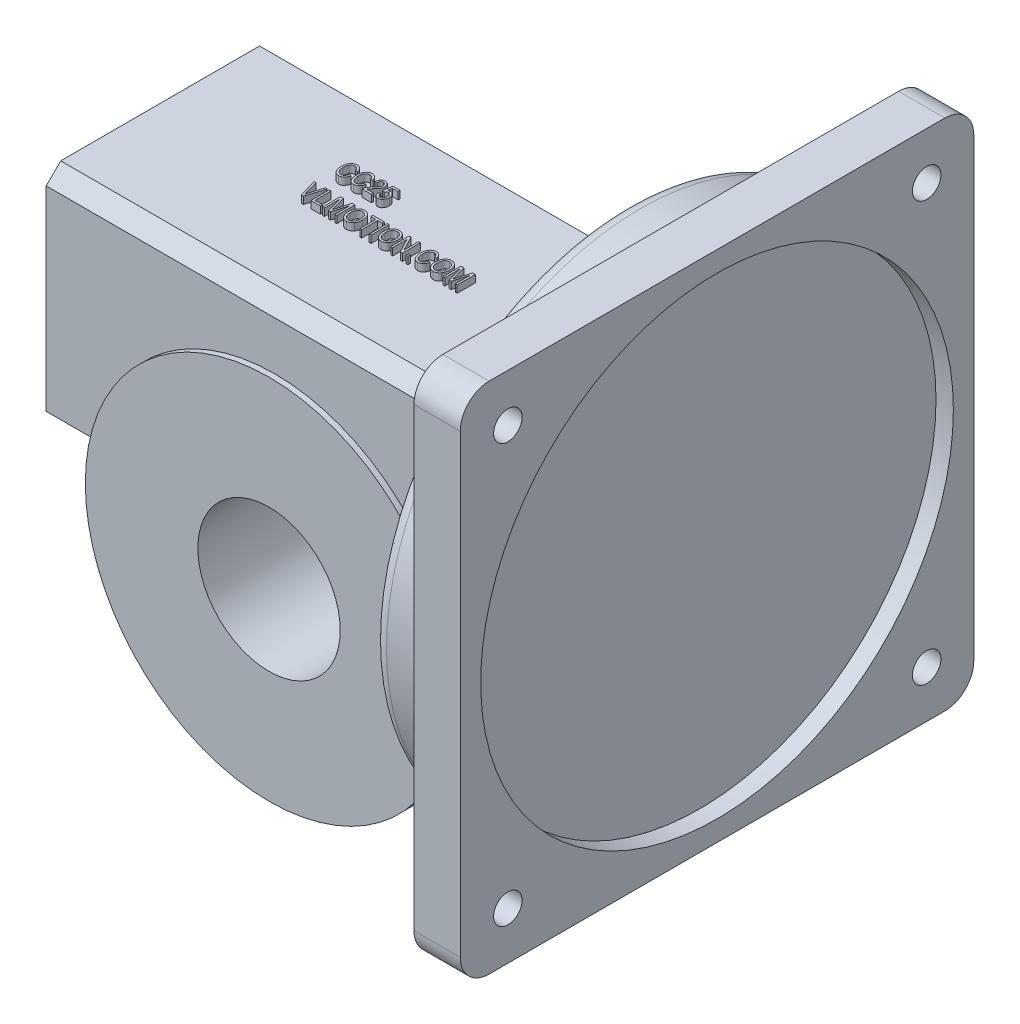
from build123d import *

# Parameters (mm, degrees)
BOSS_EXTRUDE1_DEPTH      = 21.0058
BOSS_EXTRUDE1_DEPTH_BACK = 21.0058
SKETCH1_R                = 32.258
BOSS_EXTRUDE2_DEPTH      = 41.656
BOSS_EXTRUDE2_DEPTH_BACK = 40.132
SKETCH5_R                = 44.577
BOSS_EXTRUDE3_DEPTH      = 7.874
SKETCH6_W                = 90.17
SKETCH6_H                = 90.17
BOSS_EXTRUDE4_DEPTH      = 8.128
M6_TAPPED_HOLE1_D        = 5
M6_TAPPED_HOLE1_DEPTH    = 17.018
M6_TAPPED_HOLE1_TIP      = 1.502151548
SKETCH10_R               = 41.5
CUT_EXTRUDE1_DEPTH       = 3.048
FILLET1_R                = 5.08
CHAMFER1_SIZE            = 2.54
FILLET2_R                = 2.54
SKETCH14_R               = 12.5
CUT_EXTRUDE3_DEPTH       = 113.20169044
SKETCH15_W               = 0.32987013
SKETCH15_H               = 3.175
SKETCH15_H_2             = 0.453571429
BOSS_EXTRUDE5_DEPTH      = 1.27


with BuildPart() as part:
    # Sketch1 → Boss-Extrude1 (new, two sides: drawn at the far end of the back side and taken through both)
    with BuildSketch(Plane.XY.offset(-BOSS_EXTRUDE1_DEPTH_BACK)):
        Circle(SKETCH1_R)
    extrude(amount=BOSS_EXTRUDE1_DEPTH + BOSS_EXTRUDE1_DEPTH_BACK)

    # Sketch3 → Boss-Extrude2 (add, two sides: drawn at the far end of the back side and taken through both)
    with BuildSketch(Plane(origin=(0, 0, 0), x_dir=(0, 0, -1), z_dir=(1, 0, 0)).offset(-BOSS_EXTRUDE2_DEPTH_BACK)):
        with BuildLine():
            Line((20.0025, 6.477), (20.0025, 43.307))
            Line((20.0025, 43.307), (-20.0025, 43.307))
            Line((-20.0025, 43.307), (-20.0025, 6.477))
            ThreePointArc((-20.0025, 6.477), (0, -2.296457684), (20.0025, 6.477))
        make_face()
    extrude(amount=BOSS_EXTRUDE2_DEPTH + BOSS_EXTRUDE2_DEPTH_BACK)

    # Sketch5 → Boss-Extrude3 (add)
    with BuildSketch(Plane(origin=(41.656, 0, 0), x_dir=(0, 0, -1), z_dir=(1, 0, 0))):
        with Locations((0, 24.892)):
            Circle(SKETCH5_R)
    extrude(amount=BOSS_EXTRUDE3_DEPTH)

    # Sketch6 → Boss-Extrude4 (add)
    with BuildSketch(Plane(origin=(49.53, 0, 0), x_dir=(0, 0, -1), z_dir=(1, 0, 0))):
        with Locations((0, 24.892)):
            Rectangle(SKETCH6_W, SKETCH6_H)
    extrude(amount=BOSS_EXTRUDE4_DEPTH)

    # M6 Tapped Hole1
    with Locations(Plane(origin=(57.658, 0, 0), x_dir=(0, 0, -1), z_dir=(1, 0, 0))):
        with Locations((-36.729247535, 61.621247535), (36.809857708, 61.701857708), (36.809857708, -11.917857708), (-36.729247535, -11.837247535)):
            Hole(M6_TAPPED_HOLE1_D / 2, depth=M6_TAPPED_HOLE1_DEPTH)
            with Locations((0, 0, -(M6_TAPPED_HOLE1_DEPTH + M6_TAPPED_HOLE1_TIP / 2))):  # 118° drill point
                Cone(0, M6_TAPPED_HOLE1_D / 2, M6_TAPPED_HOLE1_TIP, mode=Mode.SUBTRACT)

    # Sketch10 → Cut-Extrude1 (cut)
    with BuildSketch(Plane(origin=(57.658, 0, 0), x_dir=(0, 0, -1), z_dir=(1, 0, 0))):
        with Locations((0, 24.892)):
            Circle(SKETCH10_R)
    extrude(amount=-CUT_EXTRUDE1_DEPTH, mode=Mode.SUBTRACT)

    # Fillet1
    fillet1_edges = [part.edges().sort_by_distance(p)[0] for p in [
        (53.594, -20.193, -45.085),
        (53.594, 69.977, -45.085),
        (53.594, 69.977, 45.085),
        (53.594, -20.193, 45.085),
    ]]
    fillet(fillet1_edges, radius=FILLET1_R)

    # Chamfer1
    chamfer1_edges = [part.edges().sort_by_distance(p)[0] for p in [
        (0.762, 43.307, 20.0025),
        (0.762, 43.307, -20.0025),
    ]]
    chamfer(chamfer1_edges, length=CHAMFER1_SIZE)

    # Fillet2
    fillet2_edges = [part.edges().sort_by_distance(p)[0] for p in [
        (41.656, 24.892, 44.577),
    ]]
    fillet(fillet2_edges, radius=FILLET2_R)

    # Sketch14 → Cut-Extrude3 (cut, through all)
    with BuildSketch(Plane.XY.offset(21.0058)):
        Circle(SKETCH14_R)
    extrude(amount=-CUT_EXTRUDE3_DEPTH, mode=Mode.SUBTRACT)

    # Sketch15 → Boss-Extrude5 (add)
    # profile 1 of 16: a face of its own
    with BuildSketch(Plane(origin=(0, 43.307, 0), x_dir=(1, 0, 0), z_dir=(0, 1, 0))):
        with BuildLine():
            Line((-11.443915096, 4.568209089), (-11.114044966, 4.485741557))
            add(Edge.make_bspline(
                [(-11.114044966, 4.485741557), (-11.123876802, 4.44202771), (-11.14304478, 4.356803944), (-11.17899758, 4.234224327), (-11.22100922, 4.120460924), (-11.267929244, 4.015082752), (-11.320133895, 3.918073648), (-11.377366196, 3.829500339), (-11.440107915, 3.749435221), (-11.508671574, 3.678864235), (-11.580768402, 3.615543368), (-11.658077674, 3.562391649), (-11.738273501, 3.515809033), (-11.822888155, 3.478707992), (-11.911067573, 3.449322229), (-12.003286478, 3.429050553), (-12.099170178, 3.415466044), (-12.164599161, 3.414269391), (-12.197719885, 3.413663635)],
                knots=[0, 0, 0, 0, 1.289221957, 2.51344498, 3.673011535, 4.776835723, 5.830430132, 6.840130389, 7.808269491, 8.7523986, 9.668123701, 10.564817631, 11.447926293, 12.333367568, 13.218722559, 14.118350969, 15.047492789, 16, 16, 16, 16], degree=3))
            add(Edge.make_bspline(
                [(-12.197719885, 3.413663635), (-12.226951695, 3.414066991), (-12.284252901, 3.414857664), (-12.368579527, 3.423795752), (-12.449866992, 3.436851493), (-12.527927104, 3.456507192), (-12.60293182, 3.48056974), (-12.67415697, 3.511473049), (-12.7427599, 3.546643131), (-12.807955403, 3.588206979), (-12.870518051, 3.635293447), (-12.928768847, 3.690041231), (-12.985525448, 3.749886788), (-13.03787935, 3.81768974), (-13.089384367, 3.890746879), (-13.135688086, 3.9717898), (-13.180608218, 4.058447479), (-13.221975966, 4.15141671), (-13.260507262, 4.249762611), (-13.291973027, 4.353631197), (-13.320036933, 4.461214738), (-13.342309859, 4.573347069), (-13.360686923, 4.689562324), (-13.37232436, 4.810491244), (-13.380549475, 4.935548394), (-13.38144619, 5.020477698), (-13.381902109, 5.063658562)],
                knots=[0, 0, 0, 0, 0.921095259, 1.805562833, 2.670327692, 3.514278933, 4.340642213, 5.150451062, 5.958900505, 6.768369716, 7.58482939, 8.423223242, 9.285360719, 10.181948201, 11.120907027, 12.10087379, 13.121233649, 14.196976745, 15.307105309, 16.44839936, 17.61583717, 18.810746038, 20.050660639, 21.323136918, 22.638994396, 24, 24, 24, 24], degree=3))
            add(Edge.make_bspline(
                [(-13.381902109, 5.063658562), (-13.381449913, 5.106195572), (-13.380563014, 5.189623912), (-13.372351367, 5.312107017), (-13.360743542, 5.42982949), (-13.342301728, 5.542387281), (-13.320181163, 5.650270173), (-13.292222014, 5.752760191), (-13.260285397, 5.850700521), (-13.222308923, 5.943154536), (-13.179514337, 6.030195909), (-13.133784735, 6.112186822), (-13.085014118, 6.189134713), (-13.032086184, 6.260251329), (-12.975283502, 6.325360088), (-12.915067097, 6.385113009), (-12.85112428, 6.43913845), (-12.784194924, 6.488414009), (-12.714059074, 6.531120763), (-12.642163203, 6.56904675), (-12.567966455, 6.600515097), (-12.491739611, 6.62637396), (-12.413556349, 6.6464748), (-12.333387212, 6.660295102), (-12.25143409, 6.670042901), (-12.196030958, 6.670766268), (-12.168083115, 6.671131167)],
                knots=[0, 0, 0, 0, 1.355009242, 2.657595594, 3.909622363, 5.12221665, 6.289669639, 7.416642245, 8.504963989, 9.569716403, 10.597874851, 11.593392335, 12.559484071, 13.498222117, 14.414780627, 15.309839368, 16.198178116, 17.079506653, 17.954919271, 18.811820418, 19.667108407, 20.519600343, 21.37423126, 22.235899437, 23.110108003, 24, 24, 24, 24], degree=3))
            add(Edge.make_bspline(
                [(-12.168083115, 6.671131167), (-12.137560047, 6.670340931), (-12.07760238, 6.668788639), (-11.989042138, 6.657918297), (-11.904324334, 6.638147689), (-11.822023897, 6.612676516), (-11.74368528, 6.578243906), (-11.66829631, 6.536818922), (-11.596514524, 6.487528439), (-11.528293051, 6.430676057), (-11.46370596, 6.366965514), (-11.404216249, 6.295729399), (-11.35036699, 6.217283537), (-11.300065397, 6.132726292), (-11.256741162, 6.0399967), (-11.217678538, 5.940725497), (-11.182112959, 5.834743174), (-11.164373675, 5.760710924), (-11.155278732, 5.722754544)],
                knots=[0, 0, 0, 0, 0.969230344, 1.90389736, 2.827024372, 3.728538081, 4.635631584, 5.539103428, 6.456494714, 7.396000419, 8.355610671, 9.333534695, 10.338037519, 11.374284513, 12.454112223, 13.583699076, 14.761161004, 16, 16, 16, 16], degree=3))
            Line((-11.155278732, 5.722754544), (-11.485148862, 5.640287011))
            add(Edge.make_bspline(
                [(-11.485148862, 5.640287011), (-11.492604599, 5.667000767), (-11.507145526, 5.719100617), (-11.533021518, 5.793931883), (-11.561322733, 5.863653878), (-11.592080707, 5.92845484), (-11.626332205, 5.987772461), (-11.663076147, 6.042090126), (-11.702375424, 6.091559049), (-11.745055489, 6.135136135), (-11.78969589, 6.17445484), (-11.837664549, 6.208137434), (-11.888563188, 6.236276124), (-11.941931864, 6.259930119), (-11.997939228, 6.277722143), (-12.056769446, 6.290827275), (-12.118266148, 6.298557353), (-12.160330253, 6.299533421), (-12.181612945, 6.300027271)],
                knots=[0, 0, 0, 0, 1.274827499, 2.486296693, 3.637698816, 4.732866786, 5.781146847, 6.783409552, 7.745577291, 8.681189198, 9.583979081, 10.476943643, 11.369744444, 12.253932728, 13.156290603, 14.066553906, 15.021756508, 16, 16, 16, 16], degree=3))
            add(Edge.make_bspline(
                [(-12.181612945, 6.300027271), (-12.223620778, 6.298470923), (-12.305592691, 6.295433946), (-12.424148918, 6.270171945), (-12.534458793, 6.22976441), (-12.61841615, 6.181277821), (-12.680665541, 6.13477193), (-12.724789, 6.095012964), (-12.766335097, 6.050627116), (-12.805809602, 6.00203706), (-12.843201963, 5.948845366), (-12.876921972, 5.890404479), (-12.909624383, 5.828372351), (-12.939092752, 5.761424851), (-12.965345107, 5.689930102), (-12.988695009, 5.614042826), (-13.008609944, 5.533628722), (-13.024674278, 5.448443026), (-13.036618627, 5.358726591), (-13.045827653, 5.264405616), (-13.05077252, 5.165507552), (-13.051607007, 5.098024877), (-13.052031979, 5.063658562)],
                knots=[0, 0, 0, 0, 1.477189771, 2.882511776, 4.245778241, 5.596752156, 6.277022015, 6.978177212, 7.684002091, 8.414723124, 9.180080371, 9.969542299, 10.787683758, 11.647234596, 12.541638645, 13.466905688, 14.440346501, 15.45581228, 16.516221105, 17.624831929, 18.790418795, 20, 20, 20, 20], degree=3))
            add(Edge.make_bspline(
                [(-13.052031979, 5.063658562), (-13.051217111, 5.012100191), (-13.049636615, 4.912098925), (-13.039558758, 4.766864466), (-13.021926975, 4.631418597), (-12.9960435, 4.506212835), (-12.964071914, 4.390844282), (-12.92517353, 4.285268805), (-12.877873875, 4.189929651), (-12.823836275, 4.104628495), (-12.763543048, 4.029426897), (-12.698490299, 3.963906123), (-12.628267469, 3.908735557), (-12.553727451, 3.862862806), (-12.473760375, 3.828165288), (-12.389489048, 3.802784658), (-12.300267104, 3.787728619), (-12.239225962, 3.78576905), (-12.208028327, 3.784767531)],
                knots=[0, 0, 0, 0, 1.437104972, 2.787371166, 4.055570009, 5.241294904, 6.348053785, 7.389870239, 8.372351441, 9.308936623, 10.198930124, 11.053953419, 11.87666206, 12.682560998, 13.486679433, 14.299132302, 15.130700221, 16, 16, 16, 16], degree=3))
            add(Edge.make_bspline(
                [(-12.208028327, 3.784767531), (-12.18480282, 3.785406304), (-12.139034422, 3.786665077), (-12.071559266, 3.796067852), (-12.0062928, 3.810607266), (-11.943400402, 3.831945959), (-11.883559425, 3.860071828), (-11.825562347, 3.89281764), (-11.770607386, 3.932720619), (-11.717926127, 3.978117599), (-11.668602174, 4.030039865), (-11.623511289, 4.08843298), (-11.581973242, 4.152821077), (-11.54633897, 4.224268312), (-11.513935637, 4.301277483), (-11.485649326, 4.384558422), (-11.461769896, 4.474110655), (-11.449962402, 4.536338555), (-11.443915096, 4.568209089)],
                knots=[0, 0, 0, 0, 0.928044623, 1.828813311, 2.717973564, 3.597468745, 4.476963925, 5.35746386, 6.25552913, 7.186585864, 8.133765821, 9.112470931, 10.131597503, 11.191133367, 12.299110282, 13.469062082, 14.703759174, 16, 16, 16, 16], degree=3))
        make_face()
    # profile 2 of 16: a face of its own
    with BuildSketch(Plane(origin=(0, 43.307, 0), x_dir=(1, 0, 0), z_dir=(0, 1, 0))):
        with BuildLine():
            Line((-8.804954057, 4.568209089), (-8.475083927, 4.485741557))
            add(Edge.make_bspline(
                [(-8.475083927, 4.485741557), (-8.484915763, 4.44202771), (-8.504083741, 4.356803944), (-8.540036541, 4.234224327), (-8.582048181, 4.120460924), (-8.628968205, 4.015082752), (-8.681172856, 3.918073648), (-8.738405157, 3.829500339), (-8.801146876, 3.749435221), (-8.869710535, 3.678864235), (-8.941807363, 3.615543368), (-9.019116635, 3.562391649), (-9.099312462, 3.515809033), (-9.183927116, 3.478707992), (-9.272106534, 3.449322229), (-9.364325439, 3.429050553), (-9.460209139, 3.415466044), (-9.525638122, 3.414269391), (-9.558758846, 3.413663635)],
                knots=[0, 0, 0, 0, 1.289221957, 2.51344498, 3.673011535, 4.776835723, 5.830430132, 6.840130389, 7.808269491, 8.7523986, 9.668123701, 10.564817631, 11.447926293, 12.333367568, 13.218722559, 14.118350969, 15.047492789, 16, 16, 16, 16], degree=3))
            add(Edge.make_bspline(
                [(-9.558758846, 3.413663635), (-9.587990656, 3.414066991), (-9.645291862, 3.414857664), (-9.729618488, 3.423795752), (-9.810905953, 3.436851493), (-9.888966065, 3.456507192), (-9.963970781, 3.48056974), (-10.035195931, 3.511473049), (-10.103798861, 3.546643131), (-10.168994364, 3.588206979), (-10.231557012, 3.635293447), (-10.289807808, 3.690041231), (-10.346564409, 3.749886788), (-10.398918311, 3.81768974), (-10.450423328, 3.890746879), (-10.496727047, 3.9717898), (-10.541647179, 4.058447479), (-10.583014927, 4.15141671), (-10.621546223, 4.249762611), (-10.653011988, 4.353631197), (-10.681075894, 4.461214738), (-10.70334882, 4.573347069), (-10.721725884, 4.689562324), (-10.733363321, 4.810491244), (-10.741588436, 4.935548394), (-10.742485151, 5.020477698), (-10.74294107, 5.063658562)],
                knots=[0, 0, 0, 0, 0.921095259, 1.805562833, 2.670327692, 3.514278933, 4.340642213, 5.150451062, 5.958900505, 6.768369716, 7.58482939, 8.423223242, 9.285360719, 10.181948201, 11.120907027, 12.10087379, 13.121233649, 14.196976745, 15.307105309, 16.44839936, 17.61583717, 18.810746038, 20.050660639, 21.323136918, 22.638994396, 24, 24, 24, 24], degree=3))
            add(Edge.make_bspline(
                [(-10.74294107, 5.063658562), (-10.742488874, 5.106195572), (-10.741601975, 5.189623912), (-10.733390328, 5.312107017), (-10.721782503, 5.42982949), (-10.703340689, 5.542387281), (-10.681220124, 5.650270173), (-10.653260975, 5.752760191), (-10.621324358, 5.850700521), (-10.583347885, 5.943154536), (-10.540553298, 6.030195909), (-10.494823696, 6.112186822), (-10.446053079, 6.189134713), (-10.393125145, 6.260251329), (-10.336322463, 6.325360088), (-10.276106058, 6.385113009), (-10.212163242, 6.43913845), (-10.145233885, 6.488414009), (-10.075098035, 6.531120763), (-10.003202165, 6.56904675), (-9.929005416, 6.600515097), (-9.852778572, 6.62637396), (-9.77459531, 6.6464748), (-9.694426173, 6.660295102), (-9.612473051, 6.670042901), (-9.557069919, 6.670766268), (-9.529122077, 6.671131167)],
                knots=[0, 0, 0, 0, 1.355009242, 2.657595594, 3.909622363, 5.12221665, 6.289669639, 7.416642245, 8.504963989, 9.569716403, 10.597874851, 11.593392335, 12.559484071, 13.498222117, 14.414780627, 15.309839368, 16.198178116, 17.079506653, 17.954919271, 18.811820418, 19.667108407, 20.519600343, 21.37423126, 22.235899437, 23.110108003, 24, 24, 24, 24], degree=3))
            add(Edge.make_bspline(
                [(-9.529122077, 6.671131167), (-9.498599008, 6.670340931), (-9.438641341, 6.668788639), (-9.350081099, 6.657918297), (-9.265363295, 6.638147689), (-9.183062858, 6.612676516), (-9.104724241, 6.578243906), (-9.029335271, 6.536818922), (-8.957553485, 6.487528439), (-8.889332012, 6.430676057), (-8.824744921, 6.366965514), (-8.76525521, 6.295729399), (-8.711405951, 6.217283537), (-8.661104358, 6.132726292), (-8.617780124, 6.0399967), (-8.578717499, 5.940725497), (-8.54315192, 5.834743174), (-8.525412636, 5.760710924), (-8.516317693, 5.722754544)],
                knots=[0, 0, 0, 0, 0.969230344, 1.90389736, 2.827024372, 3.728538081, 4.635631584, 5.539103428, 6.456494714, 7.396000419, 8.355610671, 9.333534695, 10.338037519, 11.374284513, 12.454112223, 13.583699076, 14.761161004, 16, 16, 16, 16], degree=3))
            Line((-8.516317693, 5.722754544), (-8.846187823, 5.640287011))
            add(Edge.make_bspline(
                [(-8.846187823, 5.640287011), (-8.85364356, 5.667000767), (-8.868184487, 5.719100617), (-8.894060479, 5.793931883), (-8.922361694, 5.863653878), (-8.953119668, 5.92845484), (-8.987371166, 5.987772461), (-9.024115108, 6.042090126), (-9.063414385, 6.091559049), (-9.10609445, 6.135136135), (-9.150734851, 6.17445484), (-9.19870351, 6.208137434), (-9.249602149, 6.236276124), (-9.302970825, 6.259930119), (-9.358978189, 6.277722143), (-9.417808407, 6.290827275), (-9.479305109, 6.298557353), (-9.521369214, 6.299533421), (-9.542651906, 6.300027271)],
                knots=[0, 0, 0, 0, 1.274827499, 2.486296693, 3.637698816, 4.732866786, 5.781146847, 6.783409552, 7.745577291, 8.681189198, 9.583979081, 10.476943643, 11.369744444, 12.253932728, 13.156290603, 14.066553906, 15.021756508, 16, 16, 16, 16], degree=3))
            add(Edge.make_bspline(
                [(-9.542651906, 6.300027271), (-9.584659739, 6.298470923), (-9.666631652, 6.295433946), (-9.785187879, 6.270171945), (-9.895497754, 6.22976441), (-9.979455111, 6.181277821), (-10.041704502, 6.13477193), (-10.085827961, 6.095012964), (-10.127374058, 6.050627116), (-10.166848563, 6.00203706), (-10.204240924, 5.948845366), (-10.237960933, 5.890404479), (-10.270663344, 5.828372351), (-10.300131713, 5.761424851), (-10.326384068, 5.689930102), (-10.34973397, 5.614042826), (-10.369648905, 5.533628722), (-10.385713239, 5.448443026), (-10.397657588, 5.358726591), (-10.406866614, 5.264405616), (-10.411811481, 5.165507552), (-10.412645968, 5.098024877), (-10.41307094, 5.063658562)],
                knots=[0, 0, 0, 0, 1.477189771, 2.882511776, 4.245778241, 5.596752156, 6.277022015, 6.978177212, 7.684002091, 8.414723124, 9.180080371, 9.969542299, 10.787683758, 11.647234596, 12.541638645, 13.466905688, 14.440346501, 15.45581228, 16.516221105, 17.624831929, 18.790418795, 20, 20, 20, 20], degree=3))
            add(Edge.make_bspline(
                [(-10.41307094, 5.063658562), (-10.412256072, 5.012100191), (-10.410675576, 4.912098925), (-10.400597719, 4.766864466), (-10.382965936, 4.631418597), (-10.357082461, 4.506212835), (-10.325110875, 4.390844282), (-10.286212491, 4.285268805), (-10.238912836, 4.189929651), (-10.184875236, 4.104628495), (-10.124582009, 4.029426897), (-10.05952926, 3.963906123), (-9.98930643, 3.908735557), (-9.914766412, 3.862862806), (-9.834799336, 3.828165288), (-9.750528009, 3.802784658), (-9.661306065, 3.787728619), (-9.600264923, 3.78576905), (-9.569067288, 3.784767531)],
                knots=[0, 0, 0, 0, 1.437104972, 2.787371166, 4.055570009, 5.241294904, 6.348053785, 7.389870239, 8.372351441, 9.308936623, 10.198930124, 11.053953419, 11.87666206, 12.682560998, 13.486679433, 14.299132302, 15.130700221, 16, 16, 16, 16], degree=3))
            add(Edge.make_bspline(
                [(-9.569067288, 3.784767531), (-9.545841781, 3.785406304), (-9.500073383, 3.786665077), (-9.432598227, 3.796067852), (-9.367331761, 3.810607266), (-9.304439363, 3.831945959), (-9.244598386, 3.860071828), (-9.186601308, 3.89281764), (-9.131646347, 3.932720619), (-9.078965088, 3.978117599), (-9.029641135, 4.030039865), (-8.98455025, 4.08843298), (-8.943012203, 4.152821077), (-8.907377931, 4.224268312), (-8.874974598, 4.301277483), (-8.846688287, 4.384558422), (-8.822808857, 4.474110655), (-8.811001363, 4.536338555), (-8.804954057, 4.568209089)],
                knots=[0, 0, 0, 0, 0.928044623, 1.828813311, 2.717973564, 3.597468745, 4.476963925, 5.35746386, 6.25552913, 7.186585864, 8.133765821, 9.112470931, 10.131597503, 11.191133367, 12.299110282, 13.469062082, 14.703759174, 16, 16, 16, 16], degree=3))
        make_face()
    # profile 3 of 16: a face of its own
    with BuildSketch(Plane(origin=(0, 43.307, 0), x_dir=(1, 0, 0), z_dir=(0, 1, 0))):
        with BuildLine():
            Line((-6.454629382, 3.826001297), (-6.454629382, 3.454897401))
            Line((-6.454629382, 3.454897401), (-8.145213797, 3.454897401))
            add(Edge.make_bspline(
                [(-8.145213797, 3.454897401), (-8.145292072, 3.474233467), (-8.145450659, 3.513408652), (-8.140178151, 3.573134679), (-8.129345329, 3.634306708), (-8.115512922, 3.697740783), (-8.095900076, 3.76260261), (-8.071890315, 3.829207349), (-8.043560908, 3.89738918), (-8.010389758, 3.967551902), (-7.971627598, 4.040368523), (-7.924852907, 4.115534395), (-7.871097187, 4.194397821), (-7.810289349, 4.276478027), (-7.741240133, 4.360996579), (-7.665998995, 4.449208147), (-7.583492141, 4.540928999), (-7.524747085, 4.601887528), (-7.494493424, 4.633281126)],
                knots=[0, 0, 0, 0, 0.672188691, 1.361865275, 2.08134618, 2.831455259, 3.618325166, 4.435686407, 5.292818481, 6.184803937, 7.133719261, 8.159707436, 9.261705982, 10.452168352, 11.710682541, 13.056179633, 14.483934645, 16, 16, 16, 16], degree=3))
            add(Edge.make_bspline(
                [(-7.494493424, 4.633281126), (-7.459335278, 4.669646211), (-7.391641004, 4.739664354), (-7.296367777, 4.843050432), (-7.209802481, 4.939146507), (-7.133674636, 5.02969028), (-7.066632694, 5.113448569), (-7.008002139, 5.19030162), (-6.960584925, 5.261993564), (-6.909387817, 5.346349434), (-6.860578647, 5.446773761), (-6.817428576, 5.563834203), (-6.789548106, 5.676996816), (-6.786149615, 5.751602516), (-6.784499512, 5.787826581)],
                knots=[0, 0, 0, 0, 1.312560889, 2.527233899, 3.64818266, 4.668586789, 5.596397896, 6.432357998, 7.175835261, 7.825761013, 8.992224112, 10.065918602, 11.060925749, 12, 12, 12, 12], degree=3))
            add(Edge.make_bspline(
                [(-6.784499512, 5.787826581), (-6.784729596, 5.807825149), (-6.785178975, 5.846884444), (-6.792815545, 5.903926366), (-6.803706298, 5.958182069), (-6.818085321, 6.010043668), (-6.838473116, 6.058659327), (-6.862901134, 6.104366341), (-6.89151509, 6.147371726), (-6.92416796, 6.187043928), (-6.960176646, 6.222833214), (-6.99812475, 6.25498539), (-7.038999458, 6.281007871), (-7.081120813, 6.303660967), (-7.125912175, 6.320078545), (-7.172430356, 6.332592984), (-7.221105738, 6.339649194), (-7.254156661, 6.34071843), (-7.270929098, 6.341261037)],
                knots=[0, 0, 0, 0, 1.164486654, 2.274364258, 3.346924328, 4.388668322, 5.404300818, 6.412115579, 7.404820287, 8.409522099, 9.400647826, 10.360464378, 11.301161788, 12.219192522, 13.141987859, 14.073903283, 15.022558797, 16, 16, 16, 16], degree=3))
            add(Edge.make_bspline(
                [(-7.270929098, 6.341261037), (-7.289013073, 6.340881657), (-7.324313823, 6.34014109), (-7.375766969, 6.330937845), (-7.425068533, 6.318625722), (-7.471968337, 6.299530693), (-7.516123333, 6.275071123), (-7.558169593, 6.245629377), (-7.597284118, 6.210648943), (-7.634254836, 6.170872002), (-7.66666438, 6.125513683), (-7.696421096, 6.076431023), (-7.719853256, 6.021544884), (-7.739777353, 5.962547679), (-7.755381055, 5.898751697), (-7.765810885, 5.830397538), (-7.773459595, 5.75750187), (-7.773889146, 5.707313607), (-7.774109901, 5.681520777)],
                knots=[0, 0, 0, 0, 0.928788257, 1.813037313, 2.680996359, 3.53827917, 4.408273621, 5.272359245, 6.172129225, 7.102295458, 8.058839945, 9.034325244, 10.048074492, 11.120300332, 12.234644845, 13.420320921, 14.674247329, 16, 16, 16, 16], degree=3))
            Line((-7.774109901, 5.681520777), (-8.103980031, 5.722754544))
            add(Edge.make_bspline(
                [(-8.103980031, 5.722754544), (-8.100580559, 5.76103335), (-8.093985429, 5.835295971), (-8.076681641, 5.942802644), (-8.052669521, 6.042549577), (-8.024165636, 6.135531867), (-7.988304464, 6.220595555), (-7.948210537, 6.299288704), (-7.90068963, 6.369900667), (-7.847695979, 6.433304402), (-7.789673383, 6.489556442), (-7.726948866, 6.538111944), (-7.659607604, 6.579043315), (-7.58841864, 6.613459998), (-7.511910462, 6.639160843), (-7.431455628, 6.657813939), (-7.346399768, 6.668864926), (-7.288357006, 6.670364595), (-7.258687823, 6.671131167)],
                knots=[0, 0, 0, 0, 1.296155121, 2.514599762, 3.669097984, 4.755193195, 5.79120272, 6.77953026, 7.729955905, 8.65570694, 9.562583864, 10.450894749, 11.325630111, 12.216772649, 13.112585423, 14.04224033, 14.999270054, 16, 16, 16, 16], degree=3))
            add(Edge.make_bspline(
                [(-7.258687823, 6.671131167), (-7.226653691, 6.67019084), (-7.164277915, 6.668359867), (-7.073473486, 6.656295209), (-6.988781758, 6.635013967), (-6.909824442, 6.605400788), (-6.837549794, 6.566415855), (-6.770782198, 6.51965236), (-6.710635928, 6.463688745), (-6.657111237, 6.400010049), (-6.60980887, 6.331261251), (-6.568534463, 6.25937365), (-6.532732229, 6.185538416), (-6.504751772, 6.108933964), (-6.481385111, 6.030588388), (-6.466705664, 5.949314069), (-6.45637144, 5.866048765), (-6.455213347, 5.809764844), (-6.454629382, 5.781383805)],
                knots=[0, 0, 0, 0, 1.141256367, 2.222215694, 3.255808886, 4.246221905, 5.218350639, 6.173592628, 7.142736081, 8.136099926, 9.131465336, 10.11177911, 11.087094076, 12.050634184, 13.014356534, 13.995714735, 14.989343724, 16, 16, 16, 16], degree=3))
            add(Edge.make_bspline(
                [(-6.454629382, 5.781383805), (-6.455179588, 5.755813731), (-6.456272833, 5.70500672), (-6.46338448, 5.629199778), (-6.475937857, 5.554412001), (-6.492237863, 5.479924285), (-6.515367683, 5.406889961), (-6.541551873, 5.334149068), (-6.573311265, 5.262522222), (-6.610804018, 5.190611281), (-6.654703159, 5.115871493), (-6.707308851, 5.036938772), (-6.767645516, 4.951703217), (-6.838163937, 4.861683537), (-6.915447145, 4.764291016), (-7.002909382, 4.661979665), (-7.098844208, 4.553847277), (-7.166433085, 4.480475983), (-7.201347117, 4.442574958)],
                knots=[0, 0, 0, 0, 0.78053567, 1.550902233, 2.321464013, 3.094364546, 3.87611052, 4.657966429, 5.453363508, 6.265521698, 7.132350641, 8.097801917, 9.160103787, 10.319208993, 11.587678713, 12.955014444, 14.427067756, 16, 16, 16, 16], degree=3))
            add(Edge.make_bspline(
                [(-7.201347117, 4.442574958), (-7.223511738, 4.41899288), (-7.26587011, 4.373925635), (-7.325854639, 4.308712769), (-7.379682329, 4.249389435), (-7.428525105, 4.196790795), (-7.469968293, 4.149147959), (-7.50589904, 4.107719473), (-7.535257219, 4.071994695), (-7.579255913, 4.015833108), (-7.634749666, 3.936701943), (-7.67308908, 3.862101904), (-7.691642369, 3.826001297)],
                knots=[0, 0, 0, 0, 1.227496676, 2.345844757, 3.360613726, 4.265798447, 5.068085109, 5.75545707, 6.345771879, 6.821573405, 8.46188917, 10, 10, 10, 10], degree=3))
            Line((-7.691642369, 3.826001297), (-6.454629382, 3.826001297))
        make_face()
    # profile 4 of 16: a face of its own
    with BuildSketch(Plane(origin=(0, 43.307, 0), x_dir=(1, 0, 0), z_dir=(0, 1, 0))):
        with BuildLine():
            Line((-6.124759252, 4.320806492), (-5.794889122, 4.362040258))
            add(Edge.make_bspline(
                [(-5.794889122, 4.362040258), (-5.791540947, 4.336862282), (-5.785015936, 4.287794774), (-5.770484916, 4.217159779), (-5.754457318, 4.150973562), (-5.733057442, 4.090536361), (-5.711347698, 4.033905817), (-5.684509897, 3.983166611), (-5.655783933, 3.936818319), (-5.623142307, 3.896371012), (-5.589244548, 3.859977217), (-5.553135734, 3.829184901), (-5.515761069, 3.802962613), (-5.477356171, 3.780910273), (-5.437119873, 3.763963679), (-5.395506994, 3.752493363), (-5.352745615, 3.745108601), (-5.323737525, 3.74406183), (-5.309103814, 3.743533764)],
                knots=[0, 0, 0, 0, 1.411223046, 2.750228965, 4.006672634, 5.191927097, 6.311278306, 7.373684419, 8.377051755, 9.337097037, 10.257438676, 11.13782359, 11.969011532, 12.792190119, 13.594685164, 14.388253401, 15.186922146, 16, 16, 16, 16], degree=3))
            add(Edge.make_bspline(
                [(-5.309103814, 3.743533764), (-5.290803443, 3.744132075), (-5.25458662, 3.745316143), (-5.201364085, 3.75541643), (-5.149867698, 3.771359259), (-5.100889667, 3.795108779), (-5.05342202, 3.824209216), (-5.007918726, 3.859991855), (-4.965091924, 3.902851923), (-4.923825585, 3.951067919), (-4.885643318, 4.004731936), (-4.853751541, 4.064623936), (-4.826020272, 4.12862927), (-4.802449606, 4.197182569), (-4.785422673, 4.270864216), (-4.773466475, 4.349063719), (-4.765363125, 4.43188363), (-4.764492574, 4.488727973), (-4.764044966, 4.517955437)],
                knots=[0, 0, 0, 0, 0.833557162, 1.649627401, 2.46080936, 3.284070299, 4.12358479, 4.995082037, 5.915776015, 6.88098611, 7.885890802, 8.910954604, 9.967600199, 11.063514457, 12.210406555, 13.409466691, 14.668034258, 16, 16, 16, 16], degree=3))
            add(Edge.make_bspline(
                [(-4.764044966, 4.517955437), (-4.764555534, 4.545246768), (-4.765550311, 4.598420464), (-4.772807648, 4.675889321), (-4.784013756, 4.74877033), (-4.800708858, 4.816960469), (-4.822956905, 4.880072899), (-4.848258971, 4.939189403), (-4.879509238, 4.993181642), (-4.91566594, 5.041774023), (-4.954570174, 5.085739873), (-4.997044735, 5.123384104), (-5.041432746, 5.155621721), (-5.088187785, 5.182845649), (-5.138193825, 5.202224871), (-5.189985429, 5.217693149), (-5.2446392, 5.225805281), (-5.281807047, 5.227226065), (-5.300728205, 5.227949349)],
                knots=[0, 0, 0, 0, 1.312040837, 2.556345105, 3.737883698, 4.854849349, 5.925960309, 6.952388988, 7.9424386, 8.917239489, 9.860521384, 10.760061641, 11.639947922, 12.495504232, 13.352616949, 14.212152034, 15.089854369, 16, 16, 16, 16], degree=3))
            add(Edge.make_bspline(
                [(-5.300728205, 5.227949349), (-5.323575999, 5.226956162), (-5.369155028, 5.224974855), (-5.43646213, 5.208918681), (-5.501106784, 5.182041921), (-5.562945458, 5.145949971), (-5.62047787, 5.100905071), (-5.671636061, 5.046542947), (-5.717253174, 4.984582988), (-5.741364215, 4.938382278), (-5.753655356, 4.914830437)],
                knots=[0, 0, 0, 0, 0.943378558, 1.881944462, 2.841095037, 3.827409543, 4.832274565, 5.849176661, 6.903569879, 8, 8, 8, 8], degree=3))
            Line((-5.753655356, 4.914830437), (-6.083525486, 4.961862701))
            Line((-6.083525486, 4.961862701), (-5.836122888, 6.588663635))
            Line((-5.836122888, 6.588663635), (-4.557876135, 6.588663635))
            Line((-4.557876135, 6.588663635), (-4.557876135, 6.217559739))
            Line((-4.557876135, 6.217559739), (-5.559727799, 6.217559739))
            Line((-5.559727799, 6.217559739), (-5.678919154, 5.433473902))
            add(Edge.make_bspline(
                [(-5.678919154, 5.433473902), (-5.641758481, 5.452478181), (-5.568214495, 5.490089189), (-5.451196102, 5.529258577), (-5.330937624, 5.553429822), (-5.249513602, 5.556351354), (-5.208596508, 5.557819479)],
                knots=[0, 0, 0, 0, 1.017619267, 2.013951072, 3.001973272, 4, 4, 4, 4], degree=3))
            add(Edge.make_bspline(
                [(-5.208596508, 5.557819479), (-5.182985908, 5.556916409), (-5.132085726, 5.555121588), (-5.057263488, 5.541859864), (-4.984903272, 5.520631351), (-4.91534245, 5.489833522), (-4.848544577, 5.450421518), (-4.784009789, 5.402701813), (-4.722050451, 5.346586527), (-4.663987183, 5.281516895), (-4.609867167, 5.209933867), (-4.562617375, 5.131339268), (-4.522516093, 5.046794867), (-4.490695491, 4.955896416), (-4.464483227, 4.859560925), (-4.446781167, 4.756887524), (-4.436603583, 4.648306879), (-4.434997332, 4.574029571), (-4.434174836, 4.535995209)],
                knots=[0, 0, 0, 0, 0.861018809, 1.711245113, 2.547675859, 3.391805506, 4.262674834, 5.151129072, 6.086914488, 7.068866089, 8.080081396, 9.100796714, 10.1476286, 11.221399762, 12.335728169, 13.501851446, 14.720800604, 16, 16, 16, 16], degree=3))
            add(Edge.make_bspline(
                [(-4.434174836, 4.535995209), (-4.434959083, 4.498173277), (-4.436504177, 4.423657903), (-4.447461317, 4.31400308), (-4.466267701, 4.208531389), (-4.492066223, 4.10709564), (-4.524701576, 4.009513269), (-4.565585903, 3.916222795), (-4.614028301, 3.82731793), (-4.668958566, 3.743138681), (-4.730194518, 3.666317402), (-4.796836131, 3.598255777), (-4.869395616, 3.541467188), (-4.946686448, 3.494412276), (-5.029238072, 3.458072109), (-5.116925273, 3.432345868), (-5.209737956, 3.416453211), (-5.273389331, 3.414606403), (-5.305882426, 3.413663635)],
                knots=[0, 0, 0, 0, 1.144340564, 2.254537473, 3.330370625, 4.383172833, 5.418849903, 6.440219285, 7.460844228, 8.47914966, 9.47775429, 10.428908251, 11.354479858, 12.258284926, 13.160219244, 14.07516849, 15.0174017, 16, 16, 16, 16], degree=3))
            add(Edge.make_bspline(
                [(-5.305882426, 3.413663635), (-5.332977641, 3.414439573), (-5.386318675, 3.415967124), (-5.464730662, 3.427060006), (-5.5399048, 3.445748523), (-5.611888807, 3.4722715), (-5.680363346, 3.506773163), (-5.745982054, 3.548135391), (-5.807813903, 3.597544266), (-5.86657207, 3.653523099), (-5.920562334, 3.716381123), (-5.968319932, 3.785909464), (-6.010413793, 3.860841801), (-6.045889931, 3.941797247), (-6.074616048, 4.028410492), (-6.097850843, 4.120559527), (-6.115511938, 4.218491091), (-6.121628366, 4.286165311), (-6.124759252, 4.320806492)],
                knots=[0, 0, 0, 0, 0.958587677, 1.88712499, 2.795765124, 3.694982091, 4.595578744, 5.504218877, 6.434682167, 7.391400486, 8.372260331, 9.360890354, 10.371359061, 11.409147611, 12.483330096, 13.596558593, 14.769722824, 16, 16, 16, 16], degree=3))
        make_face()
    # profile 5 of 16: a face of its own
    with BuildSketch(Plane(origin=(0, 43.307, 0), x_dir=(1, 0, 0), z_dir=(0, 1, 0))):
        with BuildLine():
            Line((-12.524368627, -2.781790911), (-13.474033805, 0.393209089))
            Line((-13.474033805, 0.393209089), (-13.134499512, 0.393209089))
            Line((-13.134499512, 0.393209089), (-12.499241801, -1.910083322))
            add(Edge.make_bspline(
                [(-12.499241801, -1.910083322), (-12.487320145, -1.954080045), (-12.463914222, -2.040459315), (-12.431318083, -2.168153923), (-12.40016809, -2.290890663), (-12.38102808, -2.371362462), (-12.371674836, -2.410687015)],
                knots=[0, 0, 0, 0, 1.058778416, 2.078711773, 3.061114545, 4, 4, 4, 4], degree=3))
            add(Edge.make_bspline(
                [(-12.371674836, -2.410687015), (-12.350481342, -2.328510921), (-12.307221489, -2.16077427), (-12.257747165, -1.994763518), (-12.232510875, -1.910083322)],
                knots=[0, 0, 0, 0, 0.979822753, 2, 2, 2, 2], degree=3))
            Line((-12.232510875, -1.910083322), (-11.526382628, 0.393209089))
            Line((-11.526382628, 0.393209089), (-11.183626947, 0.393209089))
            Line((-11.183626947, 0.393209089), (-12.183545778, -2.781790911))
            Line((-12.183545778, -2.781790911), (-12.524368627, -2.781790911))
        make_face()
    # profile 6 of 16: a face of its own
    with BuildSketch(Plane(origin=(0, 43.307, 0), x_dir=(1, 0, 0), z_dir=(0, 1, 0))):
        Polygon((-10.866642369, -2.781790911), (-10.866642369, 0.393209089), (-10.536772239, 0.393209089), (-10.536772239, -2.410687015), (-9.217291719, -2.410687015), (-9.217291719, -2.781790911), align=None)
    # profile 7 of 16: a face of its own
    with BuildSketch(Plane(origin=(0, 43.307, 0), x_dir=(1, 0, 0), z_dir=(0, 1, 0))):
        with BuildLine():
            Line((-8.846187823, -2.781790911), (-8.846187823, 0.393209089))
            Line((-8.846187823, 0.393209089), (-8.330121468, 0.393209089))
            Line((-8.330121468, 0.393209089), (-7.712259252, -1.854675448))
            Line((-7.712259252, -1.854675448), (-7.588557953, -2.324998094))
            add(Edge.make_bspline(
                [(-7.588557953, -2.324998094), (-7.584522807, -2.309523228), (-7.576043859, -2.277006296), (-7.561657192, -2.225734174), (-7.545424169, -2.169623207), (-7.529053385, -2.108190979), (-7.51015196, -2.042318017), (-7.489432595, -1.971539771), (-7.467562569, -1.895504265), (-7.452605423, -1.843081276), (-7.444884049, -1.816018792)],
                knots=[0, 0, 0, 0, 0.72569615, 1.52488642, 2.416426408, 3.376296137, 4.409732583, 5.526177123, 6.722930645, 8, 8, 8, 8], degree=3))
            Line((-7.444884049, -1.816018792), (-6.798029341, 0.393209089))
            Line((-6.798029341, 0.393209089), (-6.330928083, 0.393209089))
            Line((-6.330928083, 0.393209089), (-6.330928083, -2.781790911))
            Line((-6.330928083, -2.781790911), (-6.660798213, -2.781790911))
            Line((-6.660798213, -2.781790911), (-6.660798213, -0.160869645))
            Line((-6.660798213, -0.160869645), (-7.422978611, -2.781790911))
            Line((-7.422978611, -2.781790911), (-7.760580072, -2.781790911))
            Line((-7.760580072, -2.781790911), (-8.516317693, -0.010752964))
            Line((-8.516317693, -0.010752964), (-8.516317693, -2.781790911))
            Line((-8.516317693, -2.781790911), (-8.846187823, -2.781790911))
        make_face()
    # profile 8 of 16: a face of its own
    with BuildSketch(Plane(origin=(0, 43.307, 0), x_dir=(1, 0, 0), z_dir=(0, 1, 0))):
        with BuildLine():
            add(Edge.make_bspline(
                [(-5.877356654, -1.236168955), (-5.876235193, -1.171062582), (-5.874051293, -1.044276456), (-5.857404129, -0.859940886), (-5.829125633, -0.687261758), (-5.790287326, -0.526073311), (-5.739257871, -0.376665381), (-5.677554347, -0.238457913), (-5.603844451, -0.112094538), (-5.519205773, 0.001870731), (-5.426879489, 0.103646597), (-5.327494643, 0.191858658), (-5.223143888, 0.26729448), (-5.112533711, 0.327965408), (-4.997088265, 0.376769065), (-4.875193481, 0.409433947), (-4.748293519, 0.431270521), (-4.661698642, 0.433375569), (-4.617793952, 0.434442855)],
                knots=[0, 0, 0, 0, 1.331070849, 2.592086014, 3.780305682, 4.906005075, 5.978011684, 7.003908552, 7.995748348, 8.962674125, 9.901370513, 10.800246893, 11.675154716, 12.528146756, 13.374603752, 14.231114787, 15.103152967, 16, 16, 16, 16], degree=3))
            add(Edge.make_bspline(
                [(-4.617793952, 0.434442855), (-4.588989918, 0.433805057), (-4.532099643, 0.432545354), (-4.447732779, 0.423059185), (-4.365323177, 0.408721084), (-4.284942845, 0.386907173), (-4.206152052, 0.36010971), (-4.12953731, 0.326495707), (-4.05504626, 0.286711937), (-3.982375508, 0.242023317), (-3.912639289, 0.190889047), (-3.846381233, 0.134184266), (-3.783506041, 0.072141599), (-3.725016238, 0.004270646), (-3.669937236, -0.068783549), (-3.619186913, -0.147525194), (-3.572071327, -0.231757667), (-3.528380187, -0.320916142), (-3.489056354, -0.415079396), (-3.454687414, -0.513744607), (-3.42683516, -0.617263095), (-3.402581729, -0.724620171), (-3.38502873, -0.836818536), (-3.371214987, -0.953042105), (-3.363571141, -1.073922323), (-3.362594008, -1.155839106), (-3.362096914, -1.197512299)],
                knots=[0, 0, 0, 0, 0.899824171, 1.777224896, 2.649917024, 3.510973429, 4.376801712, 5.248254587, 6.121797682, 7.013780974, 7.911701495, 8.820786024, 9.736582303, 10.668970754, 11.617827344, 12.593151753, 13.593637019, 14.632021419, 15.69381936, 16.780371356, 17.893899404, 19.04171746, 20.217729733, 21.440466177, 22.69789874, 24, 24, 24, 24], degree=3))
            add(Edge.make_bspline(
                [(-3.362096914, -1.197512299), (-3.363133581, -1.254449835), (-3.365163599, -1.365945911), (-3.379657526, -1.529250381), (-3.406015277, -1.68425816), (-3.43990382, -1.831761986), (-3.486053737, -1.970607261), (-3.541615104, -2.101495757), (-3.60679539, -2.224802585), (-3.65940085, -2.300361661), (-3.685524268, -2.337883646)],
                knots=[0, 0, 0, 0, 1.133525988, 2.219690354, 3.25996653, 4.261750254, 5.229810789, 6.168477289, 7.090481605, 8, 8, 8, 8], degree=3))
            add(Edge.make_bspline(
                [(-3.685524268, -2.337883646), (-3.715660031, -2.376358523), (-3.774563961, -2.451562243), (-3.874751954, -2.550994892), (-3.981870263, -2.634961639), (-4.095728166, -2.704571553), (-4.217114528, -2.757293365), (-4.345064013, -2.795686714), (-4.480169862, -2.818626661), (-4.572605942, -2.821539704), (-4.619726784, -2.823024677)],
                knots=[0, 0, 0, 0, 1.070119256, 2.09167529, 3.083880958, 4.046692552, 5.007570185, 5.975302747, 6.967876608, 8, 8, 8, 8], degree=3))
            add(Edge.make_bspline(
                [(-4.619726784, -2.823024677), (-4.667068889, -2.821591556), (-4.759980574, -2.81877897), (-4.895988083, -2.795030981), (-5.024637844, -2.755579463), (-5.146624092, -2.701171248), (-5.260706818, -2.630101625), (-5.36750515, -2.543542752), (-5.467698457, -2.441920765), (-5.526010409, -2.364587452), (-5.555862133, -2.324998094)],
                knots=[0, 0, 0, 0, 1.027712946, 2.016947528, 2.987811303, 3.944031492, 4.90967079, 5.89821231, 6.924028725, 8, 8, 8, 8], degree=3))
            add(Edge.make_bspline(
                [(-5.555862133, -2.324998094), (-5.581685596, -2.286769989), (-5.633179669, -2.210540057), (-5.698139248, -2.088180598), (-5.753858401, -1.960552614), (-5.798634519, -1.826740404), (-5.834515036, -1.687522017), (-5.85930053, -1.542282551), (-5.874354639, -1.39111501), (-5.87634488, -1.288390696), (-5.877356654, -1.236168955)],
                knots=[0, 0, 0, 0, 0.958933014, 1.912189966, 2.876424288, 3.85247362, 4.843745406, 5.863745303, 6.913996742, 8, 8, 8, 8], degree=3))
        make_face()
        with BuildLine():
            add(Edge.make_bspline(
                [(-5.547486525, -1.241323175), (-5.546549941, -1.287950654), (-5.544729531, -1.378579084), (-5.532680423, -1.510636616), (-5.511495902, -1.634715738), (-5.481853685, -1.750804565), (-5.444928767, -1.859243113), (-5.398104155, -1.959031604), (-5.343237544, -2.051118366), (-5.280167793, -2.134772785), (-5.210797651, -2.208928076), (-5.137865949, -2.274264016), (-5.060459434, -2.328372378), (-4.980418019, -2.374247157), (-4.895985521, -2.409296159), (-4.80786001, -2.433537165), (-4.716262624, -2.448962887), (-4.653935304, -2.450925), (-4.622303895, -2.451920781)],
                knots=[0, 0, 0, 0, 1.312267352, 2.550614609, 3.728111592, 4.851026838, 5.919546711, 6.947055793, 7.94734328, 8.931337301, 9.889295514, 10.801324679, 11.681722049, 12.542374657, 13.393208477, 14.246700222, 15.110192087, 16, 16, 16, 16], degree=3))
            add(Edge.make_bspline(
                [(-4.622303895, -2.451920781), (-4.590034873, -2.450893775), (-4.526227303, -2.448863012), (-4.432572343, -2.433831965), (-4.342942538, -2.40879052), (-4.257829673, -2.37261851), (-4.176406259, -2.327586665), (-4.099069188, -2.27218647), (-4.026094352, -2.206526881), (-3.95714111, -2.131418375), (-3.894706453, -2.046113458), (-3.839449617, -1.951610802), (-3.793849308, -1.847004691), (-3.756922159, -1.733154139), (-3.726871911, -1.610276184), (-3.707177551, -1.477632533), (-3.693628225, -1.335884115), (-3.692531354, -1.238136575), (-3.691967044, -1.187848135)],
                knots=[0, 0, 0, 0, 0.878770405, 1.737648083, 2.57658969, 3.407764765, 4.250999223, 5.106523145, 5.993164277, 6.920704469, 7.879005581, 8.867335561, 9.896730148, 10.980825599, 12.124467321, 13.338272289, 14.63061378, 16, 16, 16, 16], degree=3))
            add(Edge.make_bspline(
                [(-3.691967044, -1.187848135), (-3.692281885, -1.154765177), (-3.692901974, -1.08960746), (-3.699513682, -0.993052939), (-3.710597789, -0.899374702), (-3.72488447, -0.808005548), (-3.745586045, -0.719925161), (-3.768120343, -0.633762898), (-3.796704709, -0.550677289), (-3.818841976, -0.496863897), (-3.82984245, -0.470122891)],
                knots=[0, 0, 0, 0, 1.078644903, 2.124418214, 3.153743212, 4.154196665, 5.137842886, 6.102739285, 7.057211248, 8, 8, 8, 8], degree=3))
            add(Edge.make_bspline(
                [(-3.82984245, -0.470122891), (-3.8484308, -0.431012347), (-3.885164179, -0.35372402), (-3.960265611, -0.250299987), (-4.047201738, -0.157890521), (-4.147572545, -0.080387415), (-4.255866402, -0.016110971), (-4.371130565, 0.030177045), (-4.491676644, 0.058229504), (-4.573836003, 0.061627504), (-4.615216841, 0.063338959)],
                knots=[0, 0, 0, 0, 1.032714874, 2.040800129, 3.038924044, 4.055125724, 5.060150422, 6.038733642, 7.012177711, 8, 8, 8, 8], degree=3))
            add(Edge.make_bspline(
                [(-4.615216841, 0.063338959), (-4.648341905, 0.062312738), (-4.713640186, 0.060289785), (-4.809258124, 0.045378357), (-4.900208849, 0.020061984), (-4.986565221, -0.015143857), (-5.068902909, -0.059458746), (-5.146111596, -0.115193083), (-5.218985981, -0.180320749), (-5.286830944, -0.255622372), (-5.349428131, -0.340503525), (-5.401732247, -0.437965668), (-5.447888232, -0.544851477), (-5.484061743, -0.663406564), (-5.513329606, -0.792329162), (-5.532090517, -0.932509632), (-5.545941041, -1.083199645), (-5.546959314, -1.187382505), (-5.547486525, -1.241323175)],
                knots=[0, 0, 0, 0, 0.879508816, 1.733744975, 2.562624688, 3.381316754, 4.205651284, 5.039714663, 5.904114686, 6.796492674, 7.727389142, 8.697387403, 9.727116746, 10.814853576, 11.984051762, 13.234256004, 14.568036196, 16, 16, 16, 16], degree=3))
        make_face(mode=Mode.SUBTRACT)
    # profile 9 of 16: a face of its own
    with BuildSketch(Plane(origin=(0, 43.307, 0), x_dir=(1, 0, 0), z_dir=(0, 1, 0))):
        Polygon((-2.290018992, -2.781790911), (-2.290018992, 0.022105193), (-3.155928083, 0.022105193), (-3.155928083, 0.393209089), (-1.094239771, 0.393209089), (-1.094239771, 0.022105193), (-1.960148862, 0.022105193), (-1.960148862, -2.781790911), align=None)
    # profile 10 of 16: a face of its own
    with BuildSketch(Plane(origin=(0, 43.307, 0), x_dir=(1, 0, 0), z_dir=(0, 1, 0))):
        with Locations((-0.475733278, -1.194290911)):
            Rectangle(SKETCH15_W, SKETCH15_H)
    # profile 11 of 16: a face of its own
    with BuildSketch(Plane(origin=(0, 43.307, 0), x_dir=(1, 0, 0), z_dir=(0, 1, 0))):
        with BuildLine():
            add(Edge.make_bspline(
                [(0.225240748, -1.236168955), (0.22636221, -1.171062582), (0.22854611, -1.044276456), (0.245193274, -0.859940886), (0.273471769, -0.687261758), (0.312310077, -0.526073311), (0.363339531, -0.376665381), (0.425043055, -0.238457913), (0.498752952, -0.112094538), (0.583391629, 0.001870731), (0.675717914, 0.103646597), (0.77510276, 0.191858658), (0.879453514, 0.26729448), (0.990063692, 0.327965408), (1.105509137, 0.376769065), (1.227403922, 0.409433947), (1.354303884, 0.431270521), (1.44089876, 0.433375569), (1.484803451, 0.434442855)],
                knots=[0, 0, 0, 0, 1.331070849, 2.592086014, 3.780305682, 4.906005075, 5.978011684, 7.003908552, 7.995748348, 8.962674125, 9.901370513, 10.800246893, 11.675154716, 12.528146756, 13.374603752, 14.231114787, 15.103152967, 16, 16, 16, 16], degree=3))
            add(Edge.make_bspline(
                [(1.484803451, 0.434442855), (1.513607484, 0.433805057), (1.57049776, 0.432545354), (1.654864623, 0.423059185), (1.737274226, 0.408721084), (1.817654558, 0.386907173), (1.896445351, 0.36010971), (1.973060093, 0.326495707), (2.047551143, 0.286711937), (2.120221895, 0.242023317), (2.189958113, 0.190889047), (2.25621617, 0.134184266), (2.319091361, 0.072141599), (2.377581165, 0.004270646), (2.432660166, -0.068783549), (2.48341049, -0.147525194), (2.530526076, -0.231757667), (2.574217216, -0.320916142), (2.613541048, -0.415079396), (2.647909989, -0.513744607), (2.675762243, -0.617263095), (2.700015673, -0.724620171), (2.717568672, -0.836818536), (2.731382416, -0.953042105), (2.739026261, -1.073922323), (2.740003395, -1.155839106), (2.740500488, -1.197512299)],
                knots=[0, 0, 0, 0, 0.899824171, 1.777224896, 2.649917024, 3.510973429, 4.376801712, 5.248254587, 6.121797682, 7.013780974, 7.911701495, 8.820786024, 9.736582303, 10.668970754, 11.617827344, 12.593151753, 13.593637019, 14.632021419, 15.69381936, 16.780371356, 17.893899404, 19.04171746, 20.217729733, 21.440466177, 22.69789874, 24, 24, 24, 24], degree=3))
            add(Edge.make_bspline(
                [(2.740500488, -1.197512299), (2.739463822, -1.254449835), (2.737433804, -1.365945911), (2.722939877, -1.529250381), (2.696582125, -1.68425816), (2.662693583, -1.831761986), (2.616543666, -1.970607261), (2.560982298, -2.101495757), (2.495802012, -2.224802585), (2.443196553, -2.300361661), (2.417073135, -2.337883646)],
                knots=[0, 0, 0, 0, 1.133525988, 2.219690354, 3.25996653, 4.261750254, 5.229810789, 6.168477289, 7.090481605, 8, 8, 8, 8], degree=3))
            add(Edge.make_bspline(
                [(2.417073135, -2.337883646), (2.386937372, -2.376358523), (2.328033442, -2.451562243), (2.227845449, -2.550994892), (2.12072714, -2.634961639), (2.006869236, -2.704571553), (1.885482874, -2.757293365), (1.75753339, -2.795686714), (1.62242754, -2.818626661), (1.529991461, -2.821539704), (1.482870618, -2.823024677)],
                knots=[0, 0, 0, 0, 1.070119256, 2.09167529, 3.083880958, 4.046692552, 5.007570185, 5.975302747, 6.967876608, 8, 8, 8, 8], degree=3))
            add(Edge.make_bspline(
                [(1.482870618, -2.823024677), (1.435528513, -2.821591556), (1.342616828, -2.81877897), (1.20660932, -2.795030981), (1.077959558, -2.755579463), (0.955973311, -2.701171248), (0.841890585, -2.630101625), (0.735092252, -2.543542752), (0.634898946, -2.441920765), (0.576586993, -2.364587452), (0.546735269, -2.324998094)],
                knots=[0, 0, 0, 0, 1.027712946, 2.016947528, 2.987811303, 3.944031492, 4.90967079, 5.89821231, 6.924028725, 8, 8, 8, 8], degree=3))
            add(Edge.make_bspline(
                [(0.546735269, -2.324998094), (0.520911806, -2.286769989), (0.469417733, -2.210540057), (0.404458155, -2.088180598), (0.348739002, -1.960552614), (0.303962884, -1.826740404), (0.268082367, -1.687522017), (0.243296873, -1.542282551), (0.228242763, -1.39111501), (0.226252523, -1.288390696), (0.225240748, -1.236168955)],
                knots=[0, 0, 0, 0, 0.958933014, 1.912189966, 2.876424288, 3.85247362, 4.843745406, 5.863745303, 6.913996742, 8, 8, 8, 8], degree=3))
        make_face()
        with BuildLine():
            add(Edge.make_bspline(
                [(0.555110878, -1.241323175), (0.556047462, -1.287950654), (0.557867871, -1.378579084), (0.56991698, -1.510636616), (0.5911015, -1.634715738), (0.620743718, -1.750804565), (0.657668635, -1.859243113), (0.704493248, -1.959031604), (0.759359859, -2.051118366), (0.82242961, -2.134772785), (0.891799752, -2.208928076), (0.964731453, -2.274264016), (1.042137969, -2.328372378), (1.122179383, -2.374247157), (1.206611882, -2.409296159), (1.294737392, -2.433537165), (1.386334779, -2.448962887), (1.448662099, -2.450925), (1.480293508, -2.451920781)],
                knots=[0, 0, 0, 0, 1.312267352, 2.550614609, 3.728111592, 4.851026838, 5.919546711, 6.947055793, 7.94734328, 8.931337301, 9.889295514, 10.801324679, 11.681722049, 12.542374657, 13.393208477, 14.246700222, 15.110192087, 16, 16, 16, 16], degree=3))
            add(Edge.make_bspline(
                [(1.480293508, -2.451920781), (1.51256253, -2.450893775), (1.5763701, -2.448863012), (1.67002506, -2.433831965), (1.759654865, -2.40879052), (1.84476773, -2.37261851), (1.926191144, -2.327586665), (2.003528214, -2.27218647), (2.076503051, -2.206526881), (2.145456293, -2.131418375), (2.207890949, -2.046113458), (2.263147786, -1.951610802), (2.308748094, -1.847004691), (2.345675243, -1.733154139), (2.375725492, -1.610276184), (2.395419851, -1.477632533), (2.408969178, -1.335884115), (2.410066049, -1.238136575), (2.410630359, -1.187848135)],
                knots=[0, 0, 0, 0, 0.878770405, 1.737648083, 2.57658969, 3.407764765, 4.250999223, 5.106523145, 5.993164277, 6.920704469, 7.879005581, 8.867335561, 9.896730148, 10.980825599, 12.124467321, 13.338272289, 14.63061378, 16, 16, 16, 16], degree=3))
            add(Edge.make_bspline(
                [(2.410630359, -1.187848135), (2.410315517, -1.154765177), (2.409695429, -1.08960746), (2.403083721, -0.993052939), (2.391999613, -0.899374702), (2.377712933, -0.808005548), (2.357011357, -0.719925161), (2.334477059, -0.633762898), (2.305892693, -0.550677289), (2.283755426, -0.496863897), (2.272754953, -0.470122891)],
                knots=[0, 0, 0, 0, 1.078644903, 2.124418214, 3.153743212, 4.154196665, 5.137842886, 6.102739285, 7.057211248, 8, 8, 8, 8], degree=3))
            add(Edge.make_bspline(
                [(2.272754953, -0.470122891), (2.254166603, -0.431012347), (2.217433224, -0.35372402), (2.142331792, -0.250299987), (2.055395665, -0.157890521), (1.955024857, -0.080387415), (1.846731001, -0.016110971), (1.731466837, 0.030177045), (1.610920758, 0.058229504), (1.5287614, 0.061627504), (1.487380561, 0.063338959)],
                knots=[0, 0, 0, 0, 1.032714874, 2.040800129, 3.038924044, 4.055125724, 5.060150422, 6.038733642, 7.012177711, 8, 8, 8, 8], degree=3))
            add(Edge.make_bspline(
                [(1.487380561, 0.063338959), (1.454255497, 0.062312738), (1.388957216, 0.060289785), (1.293339278, 0.045378357), (1.202388554, 0.020061984), (1.116032181, -0.015143857), (1.033694494, -0.059458746), (0.956485806, -0.115193083), (0.883611422, -0.180320749), (0.815766459, -0.255622372), (0.753169272, -0.340503525), (0.700865156, -0.437965668), (0.654709171, -0.544851477), (0.61853566, -0.663406564), (0.589267797, -0.792329162), (0.570506886, -0.932509632), (0.556656361, -1.083199645), (0.555638089, -1.187382505), (0.555110878, -1.241323175)],
                knots=[0, 0, 0, 0, 0.879508816, 1.733744975, 2.562624688, 3.381316754, 4.205651284, 5.039714663, 5.904114686, 6.796492674, 7.727389142, 8.697387403, 9.727116746, 10.814853576, 11.984051762, 13.234256004, 14.568036196, 16, 16, 16, 16], degree=3))
        make_face(mode=Mode.SUBTRACT)
    # profile 12 of 16: a face of its own
    with BuildSketch(Plane(origin=(0, 43.307, 0), x_dir=(1, 0, 0), z_dir=(0, 1, 0))):
        Polygon((3.152838151, -2.781790911), (3.152838151, 0.393209089), (3.503969441, 0.393209089), (4.843422566, -2.137513313), (4.843422566, 0.393209089), (5.173292696, 0.393209089), (5.173292696, -2.781790911), (4.820228573, -2.781790911), (3.482708281, -0.254289896), (3.482708281, -2.781790911), align=None)
    # profile 13 of 16: a face of its own
    with BuildSketch(Plane(origin=(0, 43.307, 0), x_dir=(1, 0, 0), z_dir=(0, 1, 0))):
        with Locations((5.997968021, -2.555005197)):
            Rectangle(SKETCH15_W, SKETCH15_H_2)
    # profile 14 of 16: a face of its own
    with BuildSketch(Plane(origin=(0, 43.307, 0), x_dir=(1, 0, 0), z_dir=(0, 1, 0))):
        with BuildLine():
            Line((8.678162826, -1.668479223), (9.008032956, -1.750946755))
            add(Edge.make_bspline(
                [(9.008032956, -1.750946755), (8.99820112, -1.794660602), (8.979033142, -1.879884368), (8.943080343, -2.002463984), (8.901068702, -2.116227388), (8.854148678, -2.22160556), (8.801944027, -2.318614664), (8.744711726, -2.407187973), (8.681970007, -2.48725309), (8.613406348, -2.557824077), (8.54130952, -2.621144944), (8.464000248, -2.674296663), (8.383804421, -2.720879279), (8.299189767, -2.757980319), (8.211010349, -2.787366083), (8.118791444, -2.807637758), (8.022907744, -2.821222268), (7.957478761, -2.822418921), (7.924358037, -2.823024677)],
                knots=[0, 0, 0, 0, 1.289221957, 2.51344498, 3.673011535, 4.776835723, 5.830430132, 6.840130389, 7.808269491, 8.7523986, 9.668123701, 10.564817631, 11.447926293, 12.333367568, 13.218722559, 14.118350969, 15.047492789, 16, 16, 16, 16], degree=3))
            add(Edge.make_bspline(
                [(7.924358037, -2.823024677), (7.895126227, -2.822621321), (7.837825021, -2.821830648), (7.753498395, -2.812892559), (7.67221093, -2.799836819), (7.594150818, -2.780181119), (7.519146102, -2.756118572), (7.447920952, -2.725215262), (7.379318022, -2.690045181), (7.314122519, -2.648481333), (7.251559871, -2.601394864), (7.193309075, -2.54664708), (7.136552474, -2.486801523), (7.084198572, -2.418998572), (7.032693555, -2.345941433), (6.986389836, -2.264898511), (6.941469704, -2.178240833), (6.900101956, -2.085271602), (6.86157066, -1.986925701), (6.830104895, -1.883057115), (6.802040989, -1.775473574), (6.779768063, -1.663341242), (6.761390999, -1.547125988), (6.749753562, -1.426197068), (6.741528447, -1.301139918), (6.740631732, -1.216210613), (6.740175813, -1.17302975)],
                knots=[0, 0, 0, 0, 0.921095259, 1.805562833, 2.670327692, 3.514278933, 4.340642213, 5.150451062, 5.958900505, 6.768369716, 7.58482939, 8.423223242, 9.285360719, 10.181948201, 11.120907027, 12.10087379, 13.121233649, 14.196976745, 15.307105309, 16.44839936, 17.61583717, 18.810746038, 20.050660639, 21.323136918, 22.638994396, 24, 24, 24, 24], degree=3))
            add(Edge.make_bspline(
                [(6.740175813, -1.17302975), (6.74062801, -1.130492739), (6.741514908, -1.047064399), (6.749726555, -0.924581295), (6.76133438, -0.806858822), (6.779776194, -0.694301031), (6.801896759, -0.586418139), (6.829855908, -0.483928121), (6.861792525, -0.385987791), (6.899768999, -0.293533776), (6.942563586, -0.206492403), (6.988293187, -0.12450149), (7.037063804, -0.047553598), (7.089991738, 0.023563018), (7.14679442, 0.088671777), (7.207010825, 0.148424697), (7.270953642, 0.202450139), (7.337882998, 0.251725697), (7.408018848, 0.294432451), (7.479914719, 0.332358438), (7.554111467, 0.363826785), (7.630338311, 0.389685648), (7.708521573, 0.409786489), (7.78869071, 0.42360679), (7.870643832, 0.433354589), (7.926046964, 0.434077956), (7.953994807, 0.434442855)],
                knots=[0, 0, 0, 0, 1.355009242, 2.657595594, 3.909622363, 5.12221665, 6.289669639, 7.416642245, 8.504963989, 9.569716403, 10.597874851, 11.593392335, 12.559484071, 13.498222117, 14.414780627, 15.309839368, 16.198178116, 17.079506653, 17.954919271, 18.811820418, 19.667108407, 20.519600343, 21.37423126, 22.235899437, 23.110108003, 24, 24, 24, 24], degree=3))
            add(Edge.make_bspline(
                [(7.953994807, 0.434442855), (7.984517875, 0.433652619), (8.044475542, 0.432100327), (8.133035784, 0.421229985), (8.217753588, 0.401459377), (8.300054025, 0.375988204), (8.378392643, 0.341555594), (8.453781612, 0.30013061), (8.525563398, 0.250840127), (8.593784871, 0.193987745), (8.658371962, 0.130277202), (8.717861673, 0.059041088), (8.771710932, -0.019404775), (8.822012525, -0.10396202), (8.86533676, -0.196691612), (8.904399385, -0.295962814), (8.939964963, -0.401945138), (8.957704248, -0.475977387), (8.96679919, -0.513933768)],
                knots=[0, 0, 0, 0, 0.969230344, 1.90389736, 2.827024372, 3.728538081, 4.635631584, 5.539103428, 6.456494714, 7.396000419, 8.355610671, 9.333534695, 10.338037519, 11.374284513, 12.454112223, 13.583699076, 14.761161004, 16, 16, 16, 16], degree=3))
            Line((8.96679919, -0.513933768), (8.63692906, -0.5964013))
            add(Edge.make_bspline(
                [(8.63692906, -0.5964013), (8.629473323, -0.569687545), (8.614932396, -0.517587695), (8.589056404, -0.442756429), (8.560755189, -0.373034434), (8.529997215, -0.308233471), (8.495745717, -0.248915851), (8.459001775, -0.194598186), (8.419702498, -0.145129263), (8.377022433, -0.101552177), (8.332382032, -0.062233471), (8.284413373, -0.028550878), (8.233514734, -0.000412187), (8.180146058, 0.023241808), (8.124138694, 0.041033831), (8.065308476, 0.054138964), (8.003811774, 0.061869041), (7.961747669, 0.062845109), (7.940464977, 0.063338959)],
                knots=[0, 0, 0, 0, 1.274827499, 2.486296693, 3.637698816, 4.732866786, 5.781146847, 6.783409552, 7.745577291, 8.681189198, 9.583979081, 10.476943643, 11.369744444, 12.253932728, 13.156290603, 14.066553906, 15.021756508, 16, 16, 16, 16], degree=3))
            add(Edge.make_bspline(
                [(7.940464977, 0.063338959), (7.898457144, 0.061782611), (7.816485231, 0.058745634), (7.697929004, 0.033483634), (7.587619129, -0.006923902), (7.503661772, -0.055410491), (7.441412382, -0.101916382), (7.397288922, -0.141675348), (7.355742825, -0.186061196), (7.31626832, -0.234651252), (7.278875959, -0.287842946), (7.24515595, -0.346283833), (7.212453539, -0.408315961), (7.18298517, -0.475263461), (7.156732815, -0.54675821), (7.133382914, -0.622645486), (7.113467978, -0.703059589), (7.097403644, -0.788245286), (7.085459295, -0.877961721), (7.076250269, -0.972282696), (7.071305402, -1.071180759), (7.070470915, -1.138663435), (7.070045943, -1.17302975)],
                knots=[0, 0, 0, 0, 1.477189771, 2.882511776, 4.245778241, 5.596752156, 6.277022015, 6.978177212, 7.684002091, 8.414723124, 9.180080371, 9.969542299, 10.787683758, 11.647234596, 12.541638645, 13.466905688, 14.440346501, 15.45581228, 16.516221105, 17.624831929, 18.790418795, 20, 20, 20, 20], degree=3))
            add(Edge.make_bspline(
                [(7.070045943, -1.17302975), (7.070860811, -1.224588121), (7.072441307, -1.324589387), (7.082519164, -1.469823846), (7.100150947, -1.605269714), (7.126034422, -1.730475476), (7.158006009, -1.84584403), (7.196904392, -1.951419507), (7.244204047, -2.04675866), (7.298241647, -2.132059817), (7.358534875, -2.207261414), (7.423587623, -2.272782189), (7.493810453, -2.327952754), (7.568350471, -2.373825506), (7.648317548, -2.408523024), (7.732588875, -2.433903654), (7.821810818, -2.448959693), (7.88285196, -2.450919261), (7.914049596, -2.451920781)],
                knots=[0, 0, 0, 0, 1.437104972, 2.787371166, 4.055570009, 5.241294904, 6.348053785, 7.389870239, 8.372351441, 9.308936623, 10.198930124, 11.053953419, 11.87666206, 12.682560998, 13.486679433, 14.299132302, 15.130700221, 16, 16, 16, 16], degree=3))
            add(Edge.make_bspline(
                [(7.914049596, -2.451920781), (7.937275102, -2.451282008), (7.9830435, -2.450023235), (8.050518656, -2.44062046), (8.115785122, -2.426081046), (8.17867752, -2.404742353), (8.238518497, -2.376616483), (8.296515575, -2.343870672), (8.351470536, -2.303967693), (8.404151795, -2.258570713), (8.453475748, -2.206648447), (8.498566633, -2.148255332), (8.54010468, -2.083867234), (8.575738952, -2.012419999), (8.608142285, -1.935410828), (8.636428596, -1.85212989), (8.660308026, -1.762577656), (8.67211552, -1.700349757), (8.678162826, -1.668479223)],
                knots=[0, 0, 0, 0, 0.928044623, 1.828813311, 2.717973564, 3.597468745, 4.476963925, 5.35746386, 6.25552913, 7.186585864, 8.133765821, 9.112470931, 10.131597503, 11.191133367, 12.299110282, 13.469062082, 14.703759174, 16, 16, 16, 16], degree=3))
        make_face()
    # profile 15 of 16: a face of its own
    with BuildSketch(Plane(origin=(0, 43.307, 0), x_dir=(1, 0, 0), z_dir=(0, 1, 0))):
        with BuildLine():
            add(Edge.make_bspline(
                [(9.379136852, -1.236168955), (9.380258314, -1.171062582), (9.382442214, -1.044276456), (9.399089378, -0.859940886), (9.427367873, -0.687261758), (9.46620618, -0.526073311), (9.517235635, -0.376665381), (9.578939159, -0.238457913), (9.652649056, -0.112094538), (9.737287733, 0.001870731), (9.829614018, 0.103646597), (9.928998864, 0.191858658), (10.033349618, 0.26729448), (10.143959796, 0.327965408), (10.259405241, 0.376769065), (10.381300026, 0.409433947), (10.508199987, 0.431270521), (10.594794864, 0.433375569), (10.638699555, 0.434442855)],
                knots=[0, 0, 0, 0, 1.331070849, 2.592086014, 3.780305682, 4.906005075, 5.978011684, 7.003908552, 7.995748348, 8.962674125, 9.901370513, 10.800246893, 11.675154716, 12.528146756, 13.374603752, 14.231114787, 15.103152967, 16, 16, 16, 16], degree=3))
            add(Edge.make_bspline(
                [(10.638699555, 0.434442855), (10.667503588, 0.433805057), (10.724393864, 0.432545354), (10.808760727, 0.423059185), (10.89117033, 0.408721084), (10.971550661, 0.386907173), (11.050341455, 0.36010971), (11.126956196, 0.326495707), (11.201447247, 0.286711937), (11.274117999, 0.242023317), (11.343854217, 0.190889047), (11.410112274, 0.134184266), (11.472987465, 0.072141599), (11.531477268, 0.004270646), (11.58655627, -0.068783549), (11.637306594, -0.147525194), (11.68442218, -0.231757667), (11.72811332, -0.320916142), (11.767437152, -0.415079396), (11.801806093, -0.513744607), (11.829658347, -0.617263095), (11.853911777, -0.724620171), (11.871464776, -0.836818536), (11.88527852, -0.953042105), (11.892922365, -1.073922323), (11.893899499, -1.155839106), (11.894396592, -1.197512299)],
                knots=[0, 0, 0, 0, 0.899824171, 1.777224896, 2.649917024, 3.510973429, 4.376801712, 5.248254587, 6.121797682, 7.013780974, 7.911701495, 8.820786024, 9.736582303, 10.668970754, 11.617827344, 12.593151753, 13.593637019, 14.632021419, 15.69381936, 16.780371356, 17.893899404, 19.04171746, 20.217729733, 21.440466177, 22.69789874, 24, 24, 24, 24], degree=3))
            add(Edge.make_bspline(
                [(11.894396592, -1.197512299), (11.893359926, -1.254449835), (11.891329908, -1.365945911), (11.876835981, -1.529250381), (11.850478229, -1.68425816), (11.816589687, -1.831761986), (11.77043977, -1.970607261), (11.714878402, -2.101495757), (11.649698116, -2.224802585), (11.597092656, -2.300361661), (11.570969238, -2.337883646)],
                knots=[0, 0, 0, 0, 1.133525988, 2.219690354, 3.25996653, 4.261750254, 5.229810789, 6.168477289, 7.090481605, 8, 8, 8, 8], degree=3))
            add(Edge.make_bspline(
                [(11.570969238, -2.337883646), (11.540833476, -2.376358523), (11.481929546, -2.451562243), (11.381741553, -2.550994892), (11.274623244, -2.634961639), (11.16076534, -2.704571553), (11.039378978, -2.757293365), (10.911429494, -2.795686714), (10.776323644, -2.818626661), (10.683887565, -2.821539704), (10.636766722, -2.823024677)],
                knots=[0, 0, 0, 0, 1.070119256, 2.09167529, 3.083880958, 4.046692552, 5.007570185, 5.975302747, 6.967876608, 8, 8, 8, 8], degree=3))
            add(Edge.make_bspline(
                [(10.636766722, -2.823024677), (10.589424617, -2.821591556), (10.496512932, -2.81877897), (10.360505424, -2.795030981), (10.231855662, -2.755579463), (10.109869414, -2.701171248), (9.995786689, -2.630101625), (9.888988356, -2.543542752), (9.78879505, -2.441920765), (9.730483097, -2.364587452), (9.700631373, -2.324998094)],
                knots=[0, 0, 0, 0, 1.027712946, 2.016947528, 2.987811303, 3.944031492, 4.90967079, 5.89821231, 6.924028725, 8, 8, 8, 8], degree=3))
            add(Edge.make_bspline(
                [(9.700631373, -2.324998094), (9.67480791, -2.286769989), (9.623313837, -2.210540057), (9.558354259, -2.088180598), (9.502635106, -1.960552614), (9.457858988, -1.826740404), (9.42197847, -1.687522017), (9.397192977, -1.542282551), (9.382138867, -1.39111501), (9.380148626, -1.288390696), (9.379136852, -1.236168955)],
                knots=[0, 0, 0, 0, 0.958933014, 1.912189966, 2.876424288, 3.85247362, 4.843745406, 5.863745303, 6.913996742, 8, 8, 8, 8], degree=3))
        make_face()
        with BuildLine():
            add(Edge.make_bspline(
                [(9.709006982, -1.241323175), (9.709943566, -1.287950654), (9.711763975, -1.378579084), (9.723813083, -1.510636616), (9.744997604, -1.634715738), (9.774639822, -1.750804565), (9.811564739, -1.859243113), (9.858389351, -1.959031604), (9.913255963, -2.051118366), (9.976325713, -2.134772785), (10.045695856, -2.208928076), (10.118627557, -2.274264016), (10.196034073, -2.328372378), (10.276075487, -2.374247157), (10.360507986, -2.409296159), (10.448633496, -2.433537165), (10.540230883, -2.448962887), (10.602558203, -2.450925), (10.634189612, -2.451920781)],
                knots=[0, 0, 0, 0, 1.312267352, 2.550614609, 3.728111592, 4.851026838, 5.919546711, 6.947055793, 7.94734328, 8.931337301, 9.889295514, 10.801324679, 11.681722049, 12.542374657, 13.393208477, 14.246700222, 15.110192087, 16, 16, 16, 16], degree=3))
            add(Edge.make_bspline(
                [(10.634189612, -2.451920781), (10.666458634, -2.450893775), (10.730266204, -2.448863012), (10.823921164, -2.433831965), (10.913550968, -2.40879052), (10.998663834, -2.37261851), (11.080087248, -2.327586665), (11.157424318, -2.27218647), (11.230399155, -2.206526881), (11.299352397, -2.131418375), (11.361787053, -2.046113458), (11.41704389, -1.951610802), (11.462644198, -1.847004691), (11.499571347, -1.733154139), (11.529621596, -1.610276184), (11.549315955, -1.477632533), (11.562865282, -1.335884115), (11.563962152, -1.238136575), (11.564526462, -1.187848135)],
                knots=[0, 0, 0, 0, 0.878770405, 1.737648083, 2.57658969, 3.407764765, 4.250999223, 5.106523145, 5.993164277, 6.920704469, 7.879005581, 8.867335561, 9.896730148, 10.980825599, 12.124467321, 13.338272289, 14.63061378, 16, 16, 16, 16], degree=3))
            add(Edge.make_bspline(
                [(11.564526462, -1.187848135), (11.564211621, -1.154765177), (11.563591533, -1.08960746), (11.556979825, -0.993052939), (11.545895717, -0.899374702), (11.531609036, -0.808005548), (11.510907461, -0.719925161), (11.488373163, -0.633762898), (11.459788797, -0.550677289), (11.43765153, -0.496863897), (11.426651057, -0.470122891)],
                knots=[0, 0, 0, 0, 1.078644903, 2.124418214, 3.153743212, 4.154196665, 5.137842886, 6.102739285, 7.057211248, 8, 8, 8, 8], degree=3))
            add(Edge.make_bspline(
                [(11.426651057, -0.470122891), (11.408062707, -0.431012347), (11.371329328, -0.35372402), (11.296227896, -0.250299987), (11.209291769, -0.157890521), (11.108920961, -0.080387415), (11.000627105, -0.016110971), (10.885362941, 0.030177045), (10.764816862, 0.058229504), (10.682657503, 0.061627504), (10.641276665, 0.063338959)],
                knots=[0, 0, 0, 0, 1.032714874, 2.040800129, 3.038924044, 4.055125724, 5.060150422, 6.038733642, 7.012177711, 8, 8, 8, 8], degree=3))
            add(Edge.make_bspline(
                [(10.641276665, 0.063338959), (10.608151601, 0.062312738), (10.54285332, 0.060289785), (10.447235382, 0.045378357), (10.356284658, 0.020061984), (10.269928285, -0.015143857), (10.187590597, -0.059458746), (10.11038191, -0.115193083), (10.037507526, -0.180320749), (9.969662563, -0.255622372), (9.907065375, -0.340503525), (9.85476126, -0.437965668), (9.808605275, -0.544851477), (9.772431764, -0.663406564), (9.743163901, -0.792329162), (9.72440299, -0.932509632), (9.710552465, -1.083199645), (9.709534193, -1.187382505), (9.709006982, -1.241323175)],
                knots=[0, 0, 0, 0, 0.879508816, 1.733744975, 2.562624688, 3.381316754, 4.205651284, 5.039714663, 5.904114686, 6.796492674, 7.727389142, 8.697387403, 9.727116746, 10.814853576, 11.984051762, 13.234256004, 14.568036196, 16, 16, 16, 16], degree=3))
        make_face(mode=Mode.SUBTRACT)
    # profile 16 of 16: a face of its own
    with BuildSketch(Plane(origin=(0, 43.307, 0), x_dir=(1, 0, 0), z_dir=(0, 1, 0))):
        with BuildLine():
            Line((12.306734255, -2.781790911), (12.306734255, 0.393209089))
            Line((12.306734255, 0.393209089), (12.82280061, 0.393209089))
            Line((12.82280061, 0.393209089), (13.440662826, -1.854675448))
            Line((13.440662826, -1.854675448), (13.564364125, -2.324998094))
            add(Edge.make_bspline(
                [(13.564364125, -2.324998094), (13.568399271, -2.309523228), (13.576878219, -2.277006296), (13.591264886, -2.225734174), (13.607497909, -2.169623207), (13.623868692, -2.108190979), (13.642770118, -2.042318017), (13.663489483, -1.971539771), (13.685359509, -1.895504265), (13.700316655, -1.843081276), (13.708038029, -1.816018792)],
                knots=[0, 0, 0, 0, 0.72569615, 1.52488642, 2.416426408, 3.376296137, 4.409732583, 5.526177123, 6.722930645, 8, 8, 8, 8], degree=3))
            Line((13.708038029, -1.816018792), (14.354892737, 0.393209089))
            Line((14.354892737, 0.393209089), (14.821993995, 0.393209089))
            Line((14.821993995, 0.393209089), (14.821993995, -2.781790911))
            Line((14.821993995, -2.781790911), (14.492123865, -2.781790911))
            Line((14.492123865, -2.781790911), (14.492123865, -0.160869645))
            Line((14.492123865, -0.160869645), (13.729943467, -2.781790911))
            Line((13.729943467, -2.781790911), (13.392342006, -2.781790911))
            Line((13.392342006, -2.781790911), (12.636604385, -0.010752964))
            Line((12.636604385, -0.010752964), (12.636604385, -2.781790911))
            Line((12.636604385, -2.781790911), (12.306734255, -2.781790911))
        make_face()
    extrude(amount=BOSS_EXTRUDE5_DEPTH)


solid = part.part
